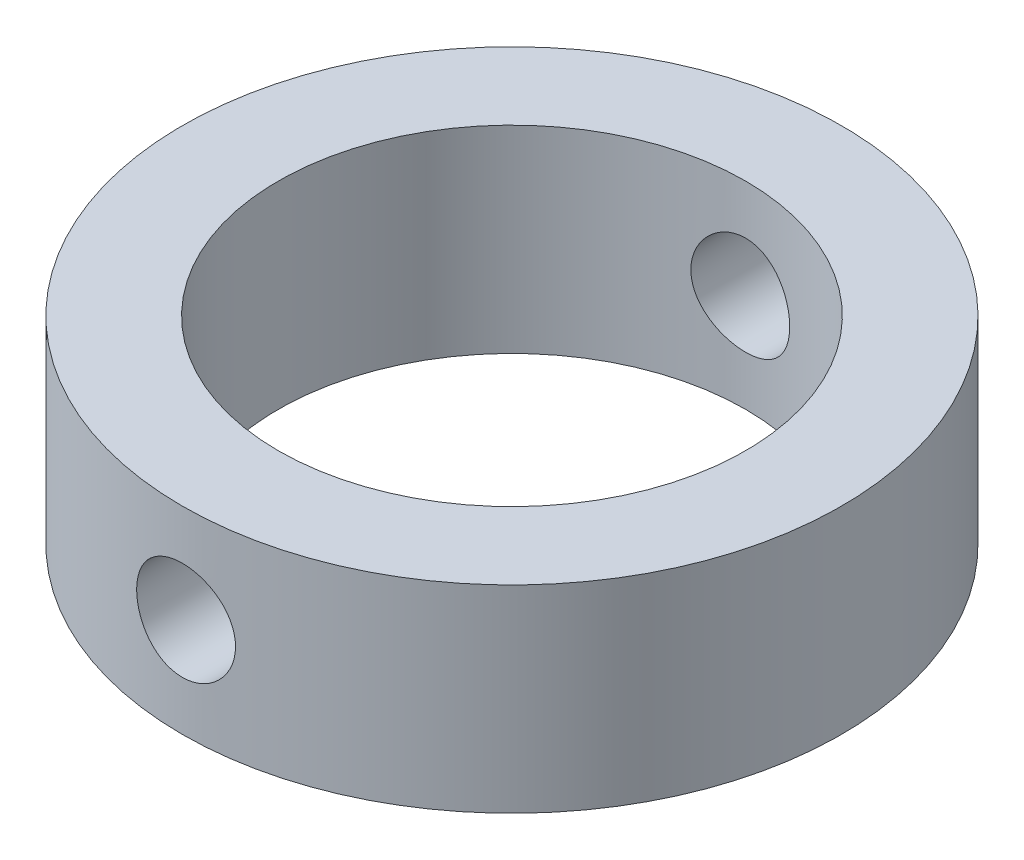
from build123d import *

# Parameters (mm, degrees)
SKETCH1_R               = 25
SKETCH1_R_2             = 17.7222
BOSS_EXTRUDE1_DEPTH     = 7.5
CUT_EXTRUDE1_DEPTH      = 37.142080737
CUT_EXTRUDE1_DEPTH_BACK = 37.142080737
SKETCH2_R               = 3.75


with BuildPart() as part:
    # Sketch1 → Boss-Extrude1 (new, symmetric)
    with BuildSketch(Plane(origin=(0, 0, 0), x_dir=(1, 0, 0), z_dir=(0, 1, 0))):
        with Locations(Location((0, 0, 0), (0, 0, 270))):
            Circle(SKETCH1_R)
        with Locations(Location((0, 0, 0), (0, 0, 270))):
            Circle(SKETCH1_R_2, mode=Mode.SUBTRACT)
    extrude(amount=BOSS_EXTRUDE1_DEPTH, both=True)

    # Sketch2 → Cut-Extrude1 (cut, two sides: drawn at the far end of the back side and taken through both)
    with BuildSketch(Plane.XY.offset(-CUT_EXTRUDE1_DEPTH_BACK)):
        Circle(SKETCH2_R)
    extrude(amount=CUT_EXTRUDE1_DEPTH + CUT_EXTRUDE1_DEPTH_BACK, mode=Mode.SUBTRACT)


solid = part.part
